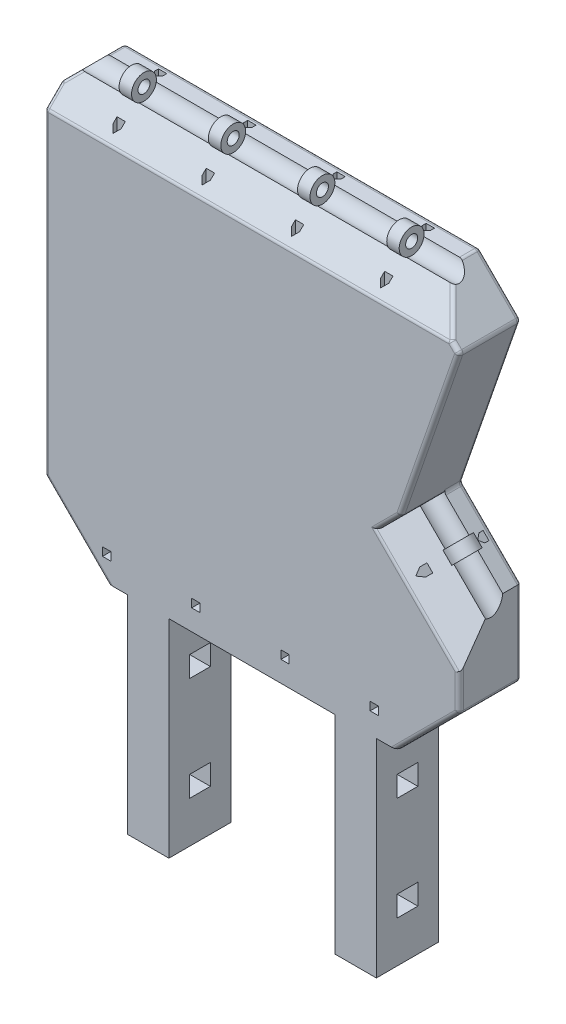
from build123d import *

# Parameters (mm, degrees)
SKETCH1_W                 = 100
SKETCH1_H                 = 100
BOSS_EXTRUDE1_DEPTH       = 7.5
CUT_EXTRUDE6_DEPTH        = 72.107313267
CUT_EXTRUDE6_DEPTH_BACK   = 72.107313267
SKETCH2_OUTSIDE_W         = 130.442
SKETCH2_OUTSIDE_H         = 130.442
CUT_EXTRUDE7_DEPTH        = 72.107313267
CUT_EXTRUDE7_DEPTH_BACK   = 72.107313267
SKETCH10_R                = 3
BOSS_EXTRUDE3_DEPTH       = 1.5
CUT_EXTRUDE8_START        = 12
SKETCH11_R                = 3
CUT_EXTRUDE8_DEPTH        = 12
LPATTERN1_COUNT           = 4
LPATTERN1_PITCH           = 21.5
LPATTERN2_COUNT           = 4
LPATTERN2_PITCH           = 21.5
LPATTERN2_START           = 12
LPATTERN2_COPY_1_SKETCH_R = 3
LPATTERN2_COPY_1_DEPTH    = 12
LPATTERN2_COPY_2_SKETCH_R = 3
LPATTERN2_COPY_2_DEPTH    = 12
LPATTERN2_COPY_3_SKETCH_R = 3
LPATTERN2_COPY_3_DEPTH    = 12
CUT_EXTRUDE10_DEPTH       = 97.11841655
CUT_EXTRUDE10_DEPTH_BACK  = 97.11841655
SKETCH13_R                = 1.45
CUT_EXTRUDE12_DEPTH       = 20
CUT_EXTRUDE12_DEPTH_BACK  = 20
SKETCH16_R                = 3
BOSS_EXTRUDE4_DEPTH       = 1.5
SKETCH17_R                = 3
CUT_EXTRUDE13_DEPTH       = 8.5
SKETCH18_R                = 1.45
CUT_EXTRUDE14_DEPTH       = 14.14
CUT_EXTRUDE16_START       = -45
CUT_EXTRUDE16_DEPTH       = 119.610461213
SKETCH20_W                = 2
SKETCH20_H                = 2
CUT_EXTRUDE17_DEPTH       = 75.124894604
LPATTERN3_COUNT           = 4
LPATTERN3_PITCH           = 21.5
LPATTERN4_COUNT           = 4
LPATTERN4_PITCH           = 21.5
CUT_EXTRUDE18_REACH       = 97.754
CUT_EXTRUDE19_START       = -45
CUT_EXTRUDE19_DEPTH       = 119.610461213
SKETCH23_W                = 2
SKETCH23_H                = 2
CUT_EXTRUDE20_DEPTH       = 75.461399396
LPATTERN5_COUNT           = 4
LPATTERN5_PITCH           = 21.5
CUT_EXTRUDE21_REACH       = 97.754
FILLET6_R                 = 1
FILLET7_R                 = 1
SKETCH25_W                = 10
SKETCH25_H                = 15
BOSS_EXTRUDE5_DEPTH       = 50
CUT_EXTRUDE22_DEPTH       = 123.295748092
CUT_EXTRUDE22_DEPTH_BACK  = 123.295748092
SKETCH26_W                = 5
SKETCH26_H                = 5
SKETCH27_R                = 3
CUT_EXTRUDE23_DEPTH       = 111.928998133


with BuildPart() as part:
    # Sketch1 → Boss-Extrude1 (new, symmetric)
    with BuildSketch(Plane.XY):
        Rectangle(SKETCH1_W, SKETCH1_H)
    extrude(amount=BOSS_EXTRUDE1_DEPTH, both=True)

    # Sketch2 outside → Cut-Extrude6 (cut, two sides: drawn at the far end of the back side and taken through both)
    with BuildSketch(Plane.XY.offset(-CUT_EXTRUDE6_DEPTH_BACK)):
        Rectangle(SKETCH2_OUTSIDE_W, SKETCH2_OUTSIDE_H)
        Polygon((-50, 45), (-45, 50), (40, 50), (50, 40), (35.857864376, -0.857864376), (50, -15), (50, -35), (35, -50), (-35, -50), (-50, -35), align=None, mode=Mode.SUBTRACT)
    extrude(amount=CUT_EXTRUDE6_DEPTH + CUT_EXTRUDE6_DEPTH_BACK, mode=Mode.SUBTRACT)

    # Sketch9 → Cut-Extrude7 (cut, two sides: drawn at the far end of the back side and taken through both)
    with BuildSketch(Plane(origin=(0, 0, 0), x_dir=(0, 0, -1), z_dir=(1, 0, 0)).offset(-CUT_EXTRUDE7_DEPTH_BACK)):
        Polygon((-7.5, 50), (0, 50), (0, 49), (-7.5, 41.5), align=None)
    extrude(amount=CUT_EXTRUDE7_DEPTH + CUT_EXTRUDE7_DEPTH_BACK, mode=Mode.SUBTRACT)

    # Sketch10 → Boss-Extrude3 (add, symmetric)
    with BuildSketch(Plane(origin=(29.5, 0, 0), x_dir=(0, 0, -1), z_dir=(1, 0, 0))):
        with Locations((0, 50.5)):
            Circle(SKETCH10_R)
    boss_extrude3 = extrude(amount=BOSS_EXTRUDE3_DEPTH, both=True)

    # Sketch11 → Cut-Extrude8 (cut)
    with BuildSketch(Plane(origin=(31, 0, 0), x_dir=(0, 0, -1), z_dir=(1, 0, 0)).offset(CUT_EXTRUDE8_START)):
        with Locations((0, 50.5)):
            Circle(SKETCH11_R)
    cut_extrude8 = extrude(amount=-CUT_EXTRUDE8_DEPTH, mode=Mode.SUBTRACT)

    # Mirror2: Cut-Extrude8 across plane
    add(cut_extrude8.mirror(Plane(origin=(29.5, 0, 0), x_dir=(0, 0, 1), z_dir=(1, 0, 0))), mode=Mode.SUBTRACT)

    # LPattern1: Boss-Extrude3 ×4
    with Locations(*[(-i * LPATTERN1_PITCH, 0, 0) for i in range(1, LPATTERN1_COUNT)]):
        add(boss_extrude3)

    # LPattern2: Cut-Extrude8 ×4
    with Locations(*[(-i * LPATTERN2_PITCH, 0, 0) for i in range(1, LPATTERN2_COUNT)]):
        add(cut_extrude8, mode=Mode.SUBTRACT)

    # LPattern2 copy 1 sketch → LPattern2 copy 1 (cut)
    with BuildSketch(Plane(origin=(6.5, 0, 0), x_dir=(0, 0, -1), z_dir=(-1, 0, 0)).offset(LPATTERN2_START)):
        with Locations((0, -50.5)):
            Circle(LPATTERN2_COPY_1_SKETCH_R)
    extrude(amount=-LPATTERN2_COPY_1_DEPTH, mode=Mode.SUBTRACT)

    # LPattern2 copy 2 sketch → LPattern2 copy 2 (cut)
    with BuildSketch(Plane(origin=(-15, 0, 0), x_dir=(0, 0, -1), z_dir=(-1, 0, 0)).offset(LPATTERN2_START)):
        with Locations((0, -50.5)):
            Circle(LPATTERN2_COPY_2_SKETCH_R)
    extrude(amount=-LPATTERN2_COPY_2_DEPTH, mode=Mode.SUBTRACT)

    # LPattern2 copy 3 sketch → LPattern2 copy 3 (cut)
    with BuildSketch(Plane(origin=(-36.5, 0, 0), x_dir=(0, 0, -1), z_dir=(-1, 0, 0)).offset(LPATTERN2_START)):
        with Locations((0, -50.5)):
            Circle(LPATTERN2_COPY_3_SKETCH_R)
    extrude(amount=-LPATTERN2_COPY_3_DEPTH, mode=Mode.SUBTRACT)

    # Sketch13 → Cut-Extrude10 (cut, two sides: drawn at the far end of the back side and taken through both)
    with BuildSketch(Plane(origin=(29.5, 0, 0), x_dir=(0, 0, -1), z_dir=(1, 0, 0)).offset(-CUT_EXTRUDE10_DEPTH_BACK)):
        with Locations((0, 50.5)):
            Circle(SKETCH13_R)
    extrude(amount=CUT_EXTRUDE10_DEPTH + CUT_EXTRUDE10_DEPTH_BACK, mode=Mode.SUBTRACT)

    # Sketch14 → Cut-Extrude12 (cut, two sides: drawn at the far end of the back side and taken through both)
    with BuildSketch(Plane(origin=(32.5, -32.5, 0), x_dir=(0, 0, 1), z_dir=(-0.7071067811865489, 0.7071067811865462, 0)).offset(-CUT_EXTRUDE12_DEPTH_BACK)):
        Polygon((7.5, 24.748737342), (0, 24.748737342), (0, 23.748737342), (7.5, 16.248737342), align=None)
    extrude(amount=CUT_EXTRUDE12_DEPTH + CUT_EXTRUDE12_DEPTH_BACK, mode=Mode.SUBTRACT)

    # Sketch16 → Boss-Extrude4 (add, symmetric)
    with BuildSketch(Plane(origin=(25.428932188, -25.428932188, 0), x_dir=(0, 0, 1), z_dir=(-0.7071067811865489, 0.7071067811865462, 0))):
        with Locations((0, 25.248737342)):
            Circle(SKETCH16_R)
    extrude(amount=BOSS_EXTRUDE4_DEPTH, both=True)

    # Sketch17 → Cut-Extrude13 (cut)
    with BuildSketch(Plane(origin=(26.48959236, -26.48959236, 0), x_dir=(0, 0, -1), z_dir=(0.707106781186549, -0.707106781186546, 0))):
        with Locations((0, 25.248737342)):
            Circle(SKETCH17_R)
    cut_extrude13 = extrude(amount=CUT_EXTRUDE13_DEPTH, mode=Mode.SUBTRACT)

    # Mirror3: Cut-Extrude13 across plane
    add(cut_extrude13.mirror(Plane(origin=(25.428932188, -25.428932188, 0), x_dir=(0, 0, 1), z_dir=(-0.7071067811865489, 0.7071067811865462, 0))), mode=Mode.SUBTRACT)

    # Sketch18 → Cut-Extrude14 (cut)
    with BuildSketch(Plane(origin=(32.5, -32.5, 0), x_dir=(0, 0, 1), z_dir=(-0.7071067811865489, 0.7071067811865462, 0))):
        with Locations(Location((0, 25.248737342, 0), (0, 0, 270))):
            Circle(SKETCH18_R)
    extrude(amount=CUT_EXTRUDE14_DEPTH, mode=Mode.SUBTRACT)

    # Sketch19 → Cut-Extrude16 (cut)
    with BuildSketch(Plane(origin=(0, 0, 0), x_dir=(1, 0, 0), z_dir=(0, 1, 0)).offset(CUT_EXTRUDE16_START)):
        Polygon((28.5, -4), (30.5, -4), (30.5, -5), (29.5, -6), (28.5, -5), align=None)
    cut_extrude16 = extrude(amount=CUT_EXTRUDE16_DEPTH, mode=Mode.SUBTRACT)

    # Sketch20 → Cut-Extrude17 (cut, through all)
    with BuildSketch(Plane.XY.offset(4)):
        with Locations((29.5, -44)):
            Rectangle(SKETCH20_W, SKETCH20_H)
    cut_extrude17 = extrude(amount=CUT_EXTRUDE17_DEPTH, mode=Mode.SUBTRACT)

    # LPattern3: Cut-Extrude16 ×4
    with Locations(*[(-i * LPATTERN3_PITCH, 0, 0) for i in range(1, LPATTERN3_COUNT)]):
        add(cut_extrude16, mode=Mode.SUBTRACT)

    # LPattern4: Cut-Extrude16, Cut-Extrude17 ×4
    with Locations(*[(-i * LPATTERN4_PITCH, 0, 0) for i in range(1, LPATTERN4_COUNT)]):
        add(cut_extrude16, mode=Mode.SUBTRACT)
        add(cut_extrude17, mode=Mode.SUBTRACT)

    # Cut-Extrude18: up to this plane
    cut_extrude18_end = Plane(origin=(28.5, -45, 5), z_dir=(-1, 0, 0))
    # Sketch21 → Cut-Extrude18 (cut, up to the surface)
    with BuildSketch(Plane(origin=(17.5, 17.5, 0), x_dir=(0, 0, -1), z_dir=(0.7071067811865464, 0.7071067811865488, 0)), mode=Mode.PRIVATE) as cut_extrude18_sk1:
        Polygon((-4, -34.961940777), (-4, -36.961940777), (-5, -36.961940777), (-6, -35.961940777), (-5, -34.961940777), align=None)
    cut_extrude18_tool1 = split(extrude(cut_extrude18_sk1.sketch, amount=-CUT_EXTRUDE18_REACH, mode=Mode.PRIVATE), bisect_by=cut_extrude18_end, keep=Keep.BOTH, mode=Mode.PRIVATE)
    add(cut_extrude18_tool1.solids().sort_by_distance((42.928932, -7.928932, 4.777778))[0], mode=Mode.SUBTRACT)

    # Sketch22 → Cut-Extrude19 (cut)
    with BuildSketch(Plane(origin=(0, 0, 0), x_dir=(1, 0, 0), z_dir=(0, 1, 0)).offset(CUT_EXTRUDE19_START)):
        Polygon((28.5, 6), (30.5, 6), (30.5, 5), (29.5, 4), (28.5, 5), align=None)
    cut_extrude19 = extrude(amount=CUT_EXTRUDE19_DEPTH, mode=Mode.SUBTRACT)

    # Sketch23 → Cut-Extrude20 (cut, through all)
    with BuildSketch(Plane.XY.offset(-6)):
        with Locations((29.5, -44)):
            Rectangle(SKETCH23_W, SKETCH23_H)
    cut_extrude20 = extrude(amount=-CUT_EXTRUDE20_DEPTH, mode=Mode.SUBTRACT)

    # LPattern5: Cut-Extrude19, Cut-Extrude20 ×4
    with Locations(*[(-i * LPATTERN5_PITCH, 0, 0) for i in range(1, LPATTERN5_COUNT)]):
        add(cut_extrude19, mode=Mode.SUBTRACT)
        add(cut_extrude20, mode=Mode.SUBTRACT)

    # Cut-Extrude21: up to this plane
    cut_extrude21_end = Plane(origin=(28.5, -45, -5), z_dir=(-1, 0, 0))
    # Sketch24 → Cut-Extrude21 (cut, up to the surface)
    with BuildSketch(Plane(origin=(17.5, 17.5, 0), x_dir=(0, 0, -1), z_dir=(0.7071067811865464, 0.7071067811865488, 0)), mode=Mode.PRIVATE) as cut_extrude21_sk1:
        Polygon((6, -34.961940777), (6, -36.961940777), (5, -36.961940777), (4, -35.961940777), (5, -34.961940777), align=None)
    cut_extrude21_tool1 = split(extrude(cut_extrude21_sk1.sketch, amount=-CUT_EXTRUDE21_REACH, mode=Mode.PRIVATE), bisect_by=cut_extrude21_end, keep=Keep.BOTH, mode=Mode.PRIVATE)
    add(cut_extrude21_tool1.solids().sort_by_distance((42.928932, -7.928932, -5.222222))[0], mode=Mode.SUBTRACT)

    # Fillet6
    fillet6_edges = [part.edges().sort_by_distance(p)[0] for p in [
        (35.857864376, -0.857864376, -5.229019946),
    ]]
    fillet(fillet6_edges, radius=FILLET6_R)

    # Fillet7
    fillet7_edges = [part.edges().sort_by_distance(p)[0] for p in [
        (36.033061753, -0.817565446, -7.5),
        (50, 40, 0),
        (45.367156742, 44.632843258, 4.367156742),
        (-48.617156742, 46.382843258, 2.617156742),
        (35.857864376, -0.857864376, 2.270980054),
        (50, -25, -7.5),
        (-45, 50, -5.229019946),
        (-2.5, 50, -7.5),
        (35, -50, 0),
        (-50, 43.25, 5.75),
        (-50, -35, 0),
        (-50, 45, -1.75),
        (-50, 5, -7.5),
        (-35, -50, 0),
        (-42.5, -42.5, -7.5),
        (50, -35, 0),
        (42.5, -42.5, -7.5),
        (43.031309814, 19.86684571, -7.5),
        (40, 50, -5.229019946),
        (45, 45, -7.5),
        (43.150252932, -8.150252932, -7.5),
        (50, -31.01040764, 7.5),
        (-50, 3.25, 7.5),
        (-0.75, 41.5, 7.5),
        (-42.5, -42.5, 7.5),
        (42.5, -42.5, 7.5),
        (42.928932188, 19.571067812, 7.5),
        (49.25, 40.75, 7.5),
        (39.923728368, -16.944543648, 7.5),
        (32.852660556, -3.863068196, 7.5),
        (-47.5, 47.5, -7.5),
    ]]
    fillet(fillet7_edges, radius=FILLET7_R)

    # Sketch25 → Boss-Extrude5 (add)
    with BuildSketch(Plane.XZ.offset(50)):
        with Locations((-25, 0)):
            Rectangle(SKETCH25_W, SKETCH25_H)
        with Locations((25, 0)):
            Rectangle(SKETCH25_W, SKETCH25_H)
    extrude(amount=BOSS_EXTRUDE5_DEPTH)

    # Sketch26 → Cut-Extrude22 (cut, two sides: drawn at the far end of the back side and taken through both)
    with BuildSketch(Plane(origin=(-20, 0, 0), x_dir=(0, 0, -1), z_dir=(1, 0, 0)).offset(-CUT_EXTRUDE22_DEPTH_BACK)):
        with Locations((0, -87.5)):
            Rectangle(SKETCH26_W, SKETCH26_H)
        with Locations((0, -62.5)):
            Rectangle(SKETCH26_W, SKETCH26_H)
    extrude(amount=CUT_EXTRUDE22_DEPTH + CUT_EXTRUDE22_DEPTH_BACK, mode=Mode.SUBTRACT)

    # Sketch27 → Cut-Extrude23 (cut, through all)
    with BuildSketch(Plane(origin=(26.48959236, -26.48959236, 0), x_dir=(0, 0, -1), z_dir=(0.7071067811865488, -0.7071067811865464, 0))):
        with Locations((0, 25.248737342)):
            Circle(SKETCH27_R)
    extrude(amount=CUT_EXTRUDE23_DEPTH, mode=Mode.SUBTRACT)


solid = part.part
